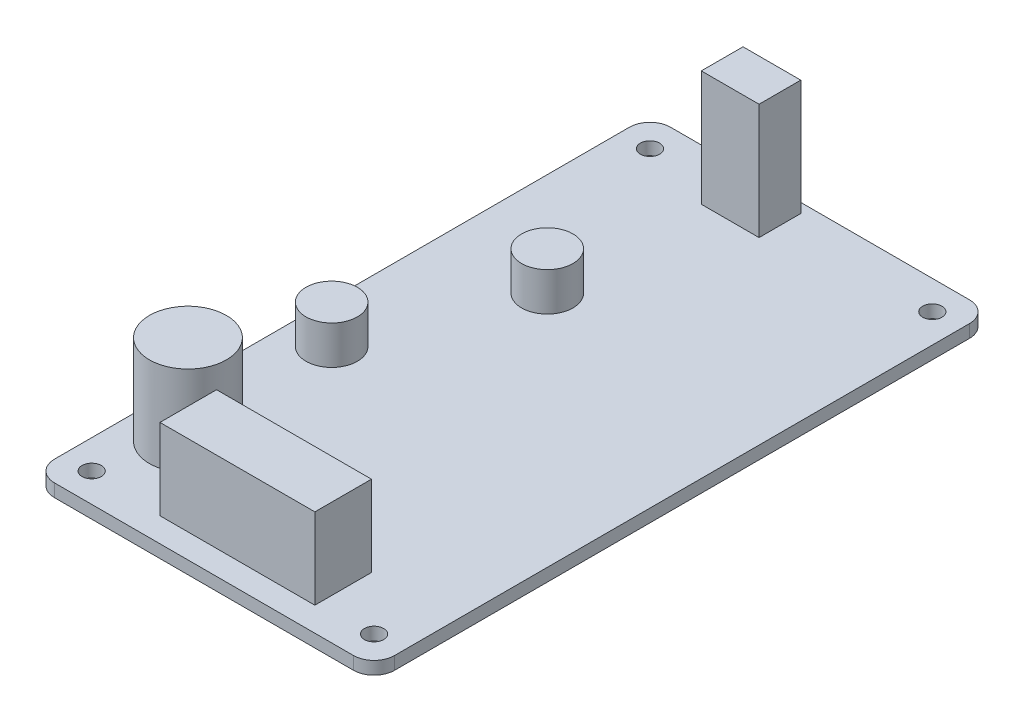
from build123d import *

# Parameters (mm, degrees)
SKETCH1_W           = 7.14375
SKETCH1_H           = 5.159375
BOSS_EXTRUDE1_DEPTH = 14.2875
SKETCH1_3_W         = 19.161125
SKETCH1_3_H         = 7
BOSS_EXTRUDE2_DEPTH = 10
BOSS_EXTRUDE3_DEPTH = 1.5875
SKETCH1_5_R         = 1.190625
CUT_EXTRUDE1_DEPTH  = 1.5875
SKETCH2_R           = 4.7625
BOSS_EXTRUDE4_DEPTH = 11.1125
SKETCH2_3_R         = 3.175
BOSS_EXTRUDE5_DEPTH = 4.7625


with BuildPart() as part:
    # Sketch1 → Boss-Extrude1 (new body)
    with BuildSketch(Plane(origin=(0, 0, 0), x_dir=(1, 0, 0), z_dir=(0, 1, 0))):
        with Locations((-4.7625, 34.3296875)):
            Rectangle(SKETCH1_W, SKETCH1_H)
    extrude(amount=BOSS_EXTRUDE1_DEPTH)



with BuildPart() as body_2:
    # Sketch1<3> → Boss-Extrude2 (new body)
    with BuildSketch(Plane(origin=(0, 0, 0), x_dir=(1, 0, 0), z_dir=(0, 1, 0))):
        with Locations((1.1350625, -31.6)):
            Rectangle(SKETCH1_3_W, SKETCH1_3_H)
    extrude(amount=BOSS_EXTRUDE2_DEPTH)


with BuildPart() as part_1:
    add(part.part)

    add(body_2.part)  # Boss-Extrude3 merges body 2
    # Sketch1<4> → Boss-Extrude3 (add)
    with BuildSketch(Plane(origin=(0, 0, 0), x_dir=(1, 0, 0), z_dir=(0, 1, 0))):
        with BuildLine():
            Line((18.494375, -38.1), (-18.494375, -38.1))
            ThreePointArc((-18.494375, -38.1), (-20.290426224, -37.356051224), (-21.034375, -35.56))
            Line((-21.034375, -35.56), (-21.034375, 35.56))
            ThreePointArc((-21.034375, 35.56), (-20.290426224, 37.356051224), (-18.494375, 38.1))
            Line((-18.494375, 38.1), (18.494375, 38.1))
            ThreePointArc((18.494375, 38.1), (20.290426224, 37.356051224), (21.034375, 35.56))
            Line((21.034375, 35.56), (21.034375, -35.56))
            ThreePointArc((21.034375, -35.56), (20.290426224, -37.356051224), (18.494375, -38.1))
        make_face()
    extrude(amount=-BOSS_EXTRUDE3_DEPTH)

    # Sketch1<5> → Cut-Extrude1 (cut)
    with BuildSketch(Plane(origin=(0, 0, 0), x_dir=(1, 0, 0), z_dir=(0, 1, 0))):
        with Locations((-17.4625, 34.528125)):
            Circle(SKETCH1_5_R)
        with Locations((17.4625, 34.528125)):
            Circle(SKETCH1_5_R)
        with Locations((17.4625, -34.528125)):
            Circle(SKETCH1_5_R)
        with Locations((-17.4625, -34.528125)):
            Circle(SKETCH1_5_R)
    extrude(amount=-CUT_EXTRUDE1_DEPTH, mode=Mode.SUBTRACT)

    # Sketch2 → Boss-Extrude4 (add)
    with BuildSketch(Plane(origin=(0, 0, 0), x_dir=(1, 0, 0), z_dir=(0, 1, 0))):
        with Locations((-14.684375, -25.4)):
            Circle(SKETCH2_R)
    extrude(amount=BOSS_EXTRUDE4_DEPTH)

    # Sketch2<3> → Boss-Extrude5 (add)
    with BuildSketch(Plane(origin=(0, 0, 0), x_dir=(1, 0, 0), z_dir=(0, 1, 0))):
        with Locations((-15.954375, -6.35)):
            Circle(SKETCH2_3_R)
        with Locations((-8.334375, 12.7)):
            Circle(SKETCH2_3_R)
    extrude(amount=BOSS_EXTRUDE5_DEPTH)


solid = part_1.part
